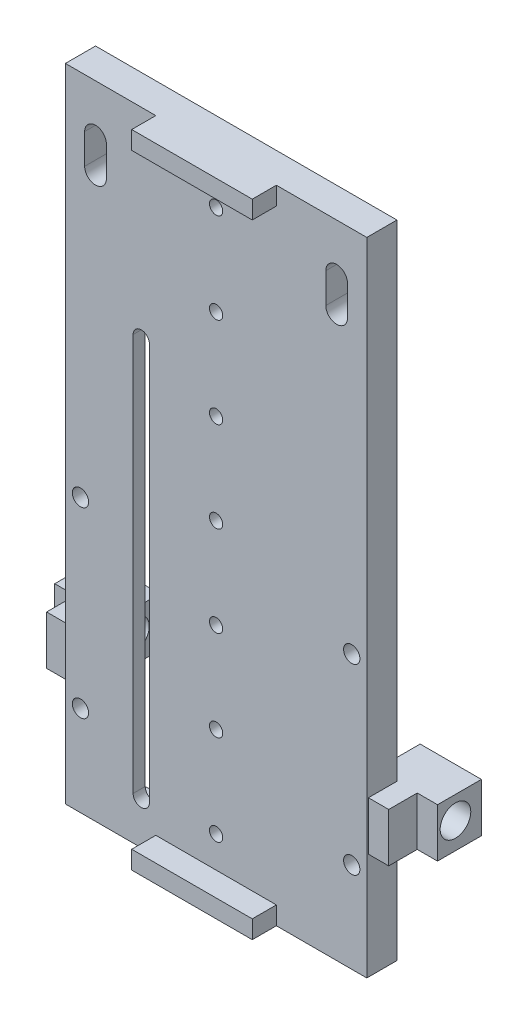
from build123d import *

# Parameters (mm, degrees)
SKETCH1_W                   = 50
SKETCH1_H                   = 106.4
BOSS_EXTRUDE1_DEPTH         = 5
SKETCH2_W                   = 20
SKETCH2_H                   = 3
BOSS_EXTRUDE2_DEPTH         = 4
TAP_DRILL_FOR_M2X0_4_TAP1_D = 2.2
LPATTERN1_COUNT             = 4
LPATTERN1_PITCH             = 15
LPATTERN1_COL_COUNT         = 4
LPATTERN1_COL_PITCH         = 15
CUT_EXTRUDE1_DEPTH          = 118.668857392
SKETCH7_W                   = 11.1694
SKETCH7_H                   = 71.9308
CUT_EXTRUDE2_DEPTH          = 3
F_2_CLEARANCE_HOLE1_D       = 2.7051
SKETCH11_R                  = 1.8
CUT_EXTRUDE3_DEPTH          = 118.906573184
BOSS_EXTRUDE5_DEPTH         = 6.731
BOSS_EXTRUDE5_DEPTH_BACK    = 56.769
SKETCH14_W                  = 7.277473249
SKETCH14_H                  = 8.107504071
SKETCH14_R                  = 2.54
SKETCH14_W_2                = 8.508813203
SKETCH14_H_2                = 9.759110034
SKETCH15_W                  = 3.3655
SKETCH15_H                  = 8.107504071
SKETCH15_W_2                = 3.3845
BOSS_EXTRUDE6_DEPTH         = 4.731
CUT_EXTRUDE4_REACH          = 123.844
SKETCH16_W                  = 43.18
SKETCH16_H                  = 8.107504071
SKETCH16_W_2                = 21.67
SKETCH16_H_2                = 9.759110034


with BuildPart() as part:
    # Sketch1 → Boss-Extrude1 (new body)
    with BuildSketch(Plane.XY):
        with Locations((25, 53.2)):
            Rectangle(SKETCH1_W, SKETCH1_H)
    extrude(amount=BOSS_EXTRUDE1_DEPTH)

    # Sketch2 → Boss-Extrude2 (add)
    with BuildSketch(Plane.XY.offset(5)):
        with Locations((25, 104.9)):
            Rectangle(SKETCH2_W, SKETCH2_H)
    boss_extrude2 = extrude(amount=BOSS_EXTRUDE2_DEPTH)

    # Mirror1: Boss-Extrude2 across plane
    add(boss_extrude2.mirror(Plane.ZX.offset(53.2)))

    # Tap Drill for M2x0.4 Tap1 (through all)
    with Locations(Plane.XY.offset(5)):
        with Locations((25, 53.2)):
            tap_drill_for_m2x0_4_tap1 = Hole(TAP_DRILL_FOR_M2X0_4_TAP1_D / 2)

    # LPattern1: Tap Drill for M2x0.4 Tap1 ×4
    with Locations(*[(0, -i * LPATTERN1_PITCH, 0) for i in range(1, LPATTERN1_COUNT)]):
        add(tap_drill_for_m2x0_4_tap1, mode=Mode.SUBTRACT)

    # LPattern1 col: Tap Drill for M2x0.4 Tap1 ×4
    with Locations(*[(0, i * LPATTERN1_COL_PITCH, 0) for i in range(1, LPATTERN1_COL_COUNT)]):
        add(tap_drill_for_m2x0_4_tap1, mode=Mode.SUBTRACT)

    # Sketch6 → Cut-Extrude1 (cut, through all)
    with BuildSketch(Plane.XY.offset(5)):
        with BuildLine():
            Line((11.2347, 7.1336), (11.2347, 73.0644))
            ThreePointArc((11.2347, 73.0644), (12.5847, 74.4144), (13.9347, 73.0644))
            Line((13.9347, 73.0644), (13.9347, 7.1336))
            ThreePointArc((13.9347, 7.1336), (12.5847, 5.7836), (11.2347, 7.1336))
        make_face()
    extrude(amount=-CUT_EXTRUDE1_DEPTH, mode=Mode.SUBTRACT)

    # Sketch7 → Cut-Extrude2 (cut)
    with BuildSketch(Plane(origin=(0, 0, 0), x_dir=(-1, 0, 0), z_dir=(0, 0, -1))):
        with Locations((-12.5847, 40.099)):
            Rectangle(SKETCH7_W, SKETCH7_H)
    extrude(amount=-CUT_EXTRUDE2_DEPTH, mode=Mode.SUBTRACT)

    # #2 Clearance Hole1 (through all)
    with Locations(Plane(origin=(0, 0, 0), x_dir=(-1, 0, 0), z_dir=(0, 0, -1))):
        with Locations((-47.5, 45.3), (-2.5, 45.3), (-2.5, 15), (-47.5, 15)):
            Hole(F_2_CLEARANCE_HOLE1_D / 2)

    # Sketch11 → Cut-Extrude3 (cut, through all)
    with BuildSketch(Plane(origin=(0, 0, 0), x_dir=(-1, 0, 0), z_dir=(0, 0, -1))):
        with BuildLine():
            Line((-46.795, 98.2156), (-46.795, 95.7156))
            ThreePointArc((-46.795, 95.7156), (-44.995, 97.5156), (-43.195, 95.7156))
            Line((-43.195, 95.7156), (-43.195, 98.2156))
            ThreePointArc((-43.195, 98.2156), (-44.995, 100.0156), (-46.795, 98.2156))
        make_face()
        with Locations((-44.995, 95.7156)):
            Circle(SKETCH11_R)
        with BuildLine():
            Line((-46.795, 95.7156), (-46.795, 93.2156))
            ThreePointArc((-46.795, 93.2156), (-44.995, 91.4156), (-43.195, 93.2156))
            Line((-43.195, 93.2156), (-43.195, 95.7156))
            ThreePointArc((-43.195, 95.7156), (-44.995, 93.9156), (-46.795, 95.7156))
        make_face()
        with BuildLine():
            Line((-6.795, 98.2156), (-6.795, 95.715599993))
            ThreePointArc((-6.795, 95.715599993), (-4.995000003, 97.5156), (-3.195, 95.7156))
            Line((-3.195, 95.7156), (-3.195, 98.2156))
            ThreePointArc((-3.195, 98.2156), (-4.995, 100.0156), (-6.795, 98.2156))
        make_face()
        with Locations((-4.995, 95.7156)):
            Circle(SKETCH11_R)
        with BuildLine():
            Line((-6.795, 95.715599993), (-6.795, 93.2156))
            ThreePointArc((-6.795, 93.2156), (-4.995, 91.4156), (-3.195, 93.2156))
            Line((-3.195, 93.2156), (-3.195, 95.7156))
            ThreePointArc((-3.195, 95.7156), (-4.994999997, 93.9156), (-6.795, 95.715599993))
        make_face()
    extrude(amount=-CUT_EXTRUDE3_DEPTH, mode=Mode.SUBTRACT)

    # Sketch14 → Boss-Extrude5 (add, two sides: drawn at the far end of the back side and taken through both)
    # profile 1 of 2: a face of its own
    with BuildSketch(Plane(origin=(50, 0, 0), x_dir=(0, 0, -1), z_dir=(1, 0, 0)).offset(-BOSS_EXTRUDE5_DEPTH_BACK)):
        with Locations((3.638736625, 21.708366631)):
            Rectangle(SKETCH14_W, SKETCH14_H)
        with Locations((2.980230777, 22)):
            Circle(SKETCH14_R, mode=Mode.SUBTRACT)
    # profile 2 of 2: a face of its own
    with BuildSketch(Plane(origin=(50, 0, 0), x_dir=(0, 0, -1), z_dir=(1, 0, 0)).offset(-BOSS_EXTRUDE5_DEPTH_BACK)):
        with Locations((4.254406602, 85.657429776)):
            Rectangle(SKETCH14_W_2, SKETCH14_H_2)
        with Locations((2.980230777, 85.5)):
            Circle(SKETCH14_R, mode=Mode.SUBTRACT)
    extrude(amount=BOSS_EXTRUDE5_DEPTH + BOSS_EXTRUDE5_DEPTH_BACK)

    # Sketch15 → Boss-Extrude6 (add)
    with BuildSketch(Plane.XY):
        with Locations((51.68275, 21.708366631)):
            Rectangle(SKETCH15_W, SKETCH15_H)
        with Locations((-1.69225, 21.708366631)):
            Rectangle(SKETCH15_W_2, SKETCH15_H)
    extrude(amount=BOSS_EXTRUDE6_DEPTH)

    # Cut-Extrude4: up to this face of the body (flat: up to its plane)
    cut_extrude4_end = Plane(part.part.faces().sort_by_distance((28.220383902, 53.923969289, 0))[0])
    # Sketch16 → Cut-Extrude4 (cut, up to the picked face)
    with BuildSketch(Plane(origin=(0, 0, -8.508813203), x_dir=(-1, 0, 0), z_dir=(0, 0, -1)), mode=Mode.PRIVATE) as cut_extrude4_sk1:
        with Locations((-24.981, 21.708366631)):
            Rectangle(SKETCH16_W, SKETCH16_H)
    cut_extrude4_tool1 = split(extrude(cut_extrude4_sk1.sketch, amount=-CUT_EXTRUDE4_REACH, mode=Mode.PRIVATE), bisect_by=cut_extrude4_end, keep=Keep.BOTH, mode=Mode.PRIVATE)
    # Sketch16 → Cut-Extrude4 (cut, up to the picked face)
    with BuildSketch(Plane(origin=(0, 0, -8.508813203), x_dir=(-1, 0, 0), z_dir=(0, 0, -1)), mode=Mode.PRIVATE) as cut_extrude4_sk2:
        Polygon((-19.901, 80.777874759), (-30.061, 90.536984793), (-30.061, 80.777874759), align=None)
    cut_extrude4_tool2 = split(extrude(cut_extrude4_sk2.sketch, amount=-CUT_EXTRUDE4_REACH, mode=Mode.PRIVATE), bisect_by=cut_extrude4_end, keep=Keep.BOTH, mode=Mode.PRIVATE)
    # Sketch16 → Cut-Extrude4 (cut, up to the picked face)
    with BuildSketch(Plane(origin=(0, 0, -8.508813203), x_dir=(-1, 0, 0), z_dir=(0, 0, -1)), mode=Mode.PRIVATE) as cut_extrude4_sk3:
        Polygon((-19.901, 90.536984793), (-30.061, 90.536984793), (-19.901, 80.777874759), align=None)
    cut_extrude4_tool3 = split(extrude(cut_extrude4_sk3.sketch, amount=-CUT_EXTRUDE4_REACH, mode=Mode.PRIVATE), bisect_by=cut_extrude4_end, keep=Keep.BOTH, mode=Mode.PRIVATE)
    # Sketch16 → Cut-Extrude4 (cut, up to the picked face)
    with BuildSketch(Plane(origin=(0, 0, -8.508813203), x_dir=(-1, 0, 0), z_dir=(0, 0, -1)), mode=Mode.PRIVATE) as cut_extrude4_sk4:
        with Locations((-45.896, 85.657429776)):
            Rectangle(SKETCH16_W_2, SKETCH16_H_2)
    cut_extrude4_tool4 = split(extrude(cut_extrude4_sk4.sketch, amount=-CUT_EXTRUDE4_REACH, mode=Mode.PRIVATE), bisect_by=cut_extrude4_end, keep=Keep.BOTH, mode=Mode.PRIVATE)
    # Sketch16 → Cut-Extrude4 (cut, up to the picked face)
    with BuildSketch(Plane(origin=(0, 0, -8.508813203), x_dir=(-1, 0, 0), z_dir=(0, 0, -1)), mode=Mode.PRIVATE) as cut_extrude4_sk5:
        with Locations((-4.066, 85.657429776)):
            Rectangle(SKETCH16_W_2, SKETCH16_H_2)
    cut_extrude4_tool5 = split(extrude(cut_extrude4_sk5.sketch, amount=-CUT_EXTRUDE4_REACH, mode=Mode.PRIVATE), bisect_by=cut_extrude4_end, keep=Keep.BOTH, mode=Mode.PRIVATE)
    add(cut_extrude4_tool1.solids().sort_by(Axis((24.981, 21.708367, -8.508813), (0, 0, 1)))[0], mode=Mode.SUBTRACT)
    add(cut_extrude4_tool2.solids().sort_by(Axis((26.674333, 84.030911, -8.508813), (0, 0, 1)))[0], mode=Mode.SUBTRACT)
    add(cut_extrude4_tool3.solids().sort_by(Axis((23.287667, 87.283948, -8.508813), (0, 0, 1)))[0], mode=Mode.SUBTRACT)
    add(cut_extrude4_tool4.solids().sort_by(Axis((45.896, 85.65743, -8.508813), (0, 0, 1)))[0], mode=Mode.SUBTRACT)
    add(cut_extrude4_tool5.solids().sort_by(Axis((4.066, 85.65743, -8.508813), (0, 0, 1)))[0], mode=Mode.SUBTRACT)


solid = part.part
